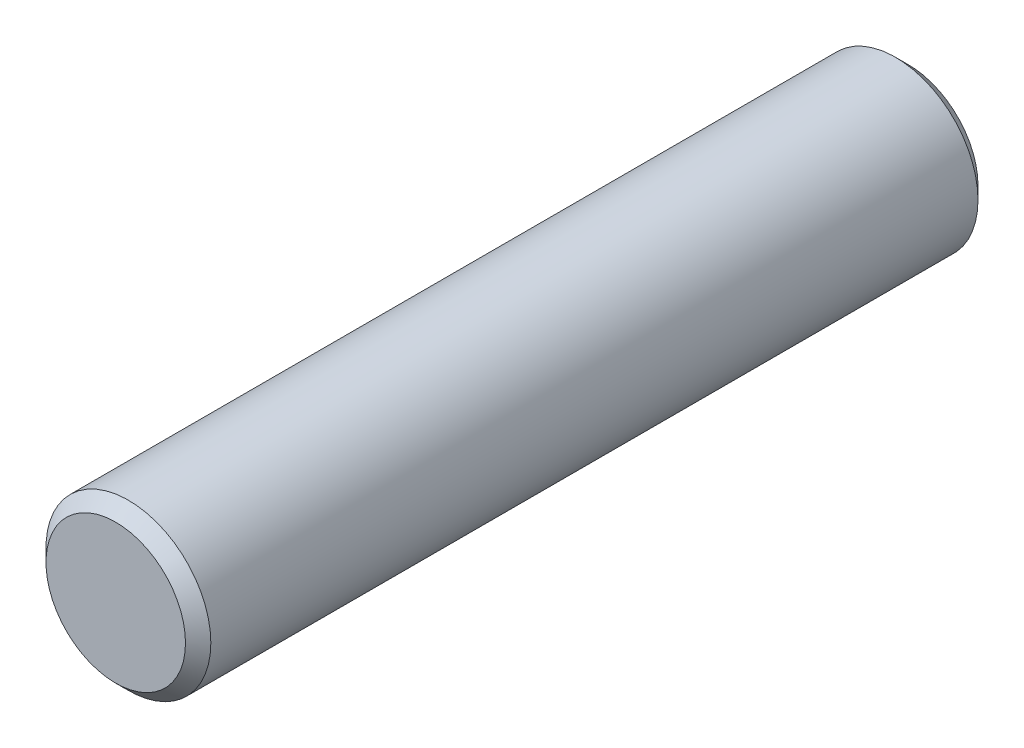
from build123d import *

# Parameters (mm, degrees)
SKETCH1_R           = 1.651
BOSS_EXTRUDE1_DEPTH = 15.875
CHAMFER1_SIZE       = 0.254


with BuildPart() as part:
    # Sketch1 → Boss-Extrude1 (new body)
    with BuildSketch(Plane.XY):
        Circle(SKETCH1_R)
    extrude(amount=BOSS_EXTRUDE1_DEPTH)

    # Chamfer1
    chamfer1_edges = [part.edges().sort_by_distance(p)[0] for p in [
        (-1.651, 0, 0),
        (-1.651, 0, 15.875),
    ]]
    chamfer(chamfer1_edges, length=CHAMFER1_SIZE)


solid = part.part
